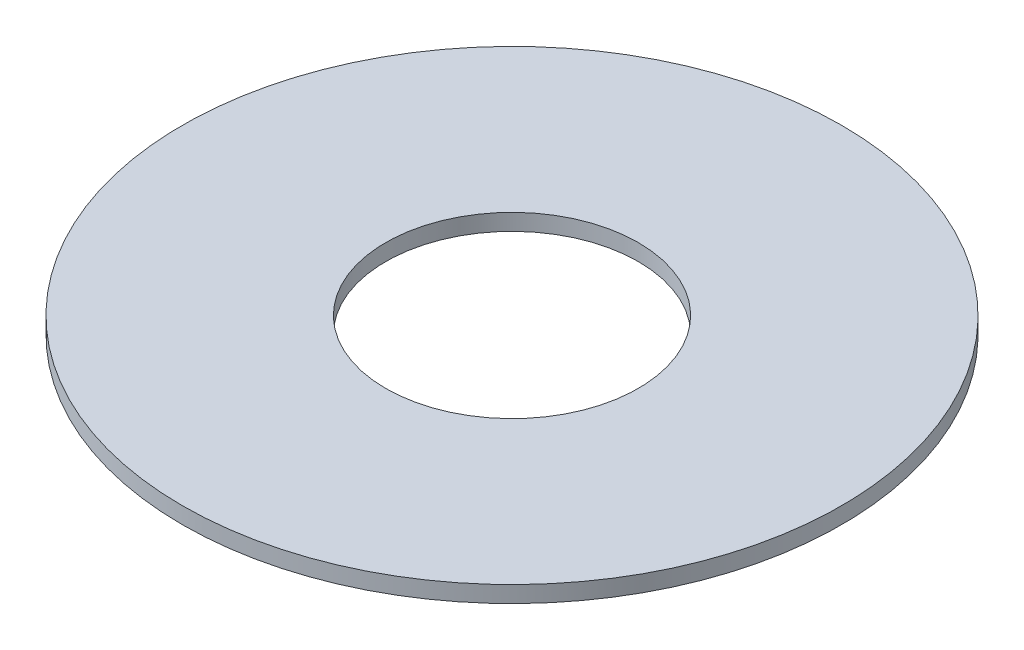
from build123d import *

# Parameters (mm, degrees)
SKETCH1_R           = 30
SKETCH1_R_2         = 11.5
BOSS_EXTRUDE1_DEPTH = 1.5


with BuildPart() as part:
    # Sketch1 → Boss-Extrude1 (new body)
    with BuildSketch(Plane(origin=(0, 0, 0), x_dir=(1, 0, 0), z_dir=(0, 1, 0))):
        with Locations(Location((0, 0, 0), (0, 0, 270))):
            Circle(SKETCH1_R)
        with Locations(Location((0, 0, 0), (0, 0, 270))):
            Circle(SKETCH1_R_2, mode=Mode.SUBTRACT)
    extrude(amount=BOSS_EXTRUDE1_DEPTH)


solid = part.part
